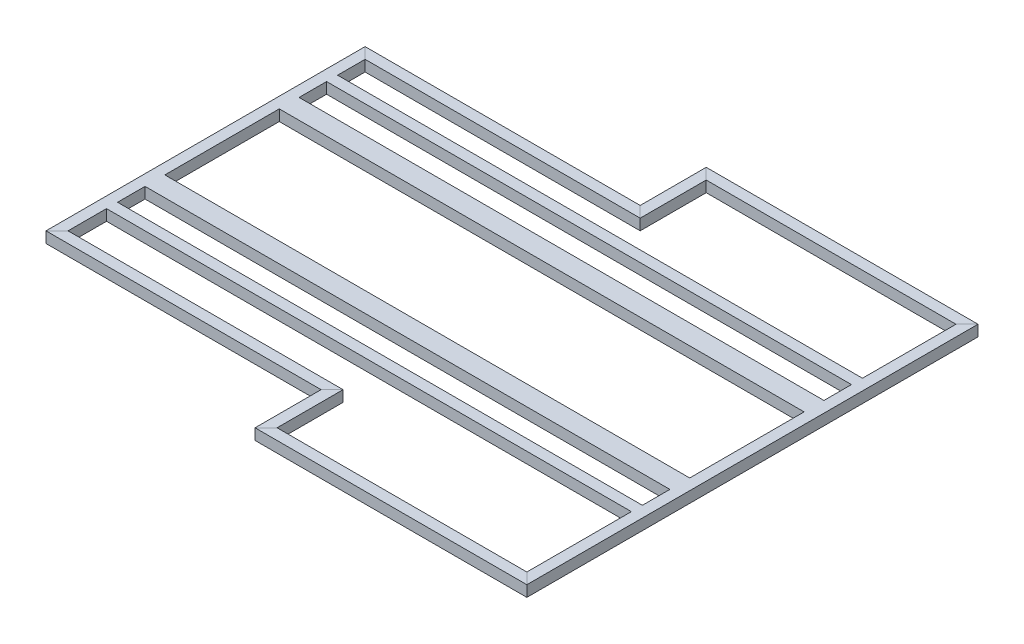
from build123d import *

# Parameters (mm, degrees)
SKETCH2_W           = 50
SKETCH2_H           = 50
BOSS_EXTRUDE1_DEPTH = 2435
CUT_EXTRUDE1_DEPTH  = 80
SKETCH6_W           = 50
SKETCH6_H           = 50
SKETCH6_W_2         = 40
SKETCH6_H_2         = 40
BOSS_EXTRUDE2_DEPTH = 2435
SKETCH7_W           = 40
SKETCH7_H           = 40
CUT_EXTRUDE2_DEPTH  = 80


with BuildPart() as part:
    # Sweep1: sweep along a path in Sketch1
    with BuildLine(Plane(origin=(0, 0, 0), x_dir=(1, 0, 0), z_dir=(0, 1, 0))) as sweep1_path:
        Line((1250, -1400), (1250, -1700))
        Line((1250, -1700), (2435, -1700))
        Line((2435, -1700), (2435, 300))
        Line((2435, 300), (1250, 300))
        Line((1250, 300), (1250, 0))
        Line((1250, 0), (0, 0))
        Line((0, 0), (0, -1400))
        Line((0, -1400), (1250, -1400))
    # Sketch2 → Sweep1 (sweep)
    with BuildSketch(Plane(origin=(0, 0, 0), x_dir=(0, 0, -1), z_dir=(1, 0, 0))):
        Rectangle(SKETCH2_W, SKETCH2_H)
    sweep(path=sweep1_path.line, transition=Transition.RIGHT)

    # Sketch3 → Boss-Extrude1 (add)
    with BuildSketch(Plane.ZY.offset(25)):
        Polygon((415, 25), (325, 25), (325, -25), (355, -25), (355, -20), (330, -20), (330, 20), (410, 20), (410, -20), (385, -20), (385, -25), (415, -25), align=None)
    boss_extrude1 = extrude(amount=-BOSS_EXTRUDE1_DEPTH)

    # Sketch5 → Cut-Extrude1 (cut)
    with BuildSketch(Plane(origin=(25, 0, 0), x_dir=(0, 0, -1), z_dir=(1, 0, 0))):
        Polygon((-385, -25), (-355, -25), (-355, -20), (-330, -20), (-330, 20), (-410, 20), (-410, -20), (-385, -20), align=None)
    cut_extrude1 = extrude(amount=-CUT_EXTRUDE1_DEPTH, mode=Mode.SUBTRACT)

    # Mirror1: Boss-Extrude1, Cut-Extrude1 across plane
    add(boss_extrude1.mirror(Plane(origin=(0, 0, 675), x_dir=(1, 0, 0), z_dir=(0, 0, -1))))
    add(cut_extrude1.mirror(Plane(origin=(0, 0, 675), x_dir=(1, 0, 0), z_dir=(0, 0, -1))), mode=Mode.SUBTRACT)

    # Sketch6 → Boss-Extrude2 (add)
    with BuildSketch(Plane.ZY.offset(25)):
        with Locations((175, 0)):
            Rectangle(SKETCH6_W, SKETCH6_H)
        with Locations((175, 0)):
            Rectangle(SKETCH6_W_2, SKETCH6_H_2, mode=Mode.SUBTRACT)
    boss_extrude2 = extrude(amount=-BOSS_EXTRUDE2_DEPTH)

    # Sketch7 → Cut-Extrude2 (cut)
    with BuildSketch(Plane.ZY.offset(25)):
        with Locations((175, 0)):
            Rectangle(SKETCH7_W, SKETCH7_H)
    cut_extrude2 = extrude(amount=-CUT_EXTRUDE2_DEPTH, mode=Mode.SUBTRACT)

    # Mirror2: Boss-Extrude2, Cut-Extrude2 across plane
    add(boss_extrude2.mirror(Plane(origin=(0, 0, 675), x_dir=(1, 0, 0), z_dir=(0, 0, -1))))
    add(cut_extrude2.mirror(Plane(origin=(0, 0, 675), x_dir=(1, 0, 0), z_dir=(0, 0, -1))), mode=Mode.SUBTRACT)


solid = part.part
